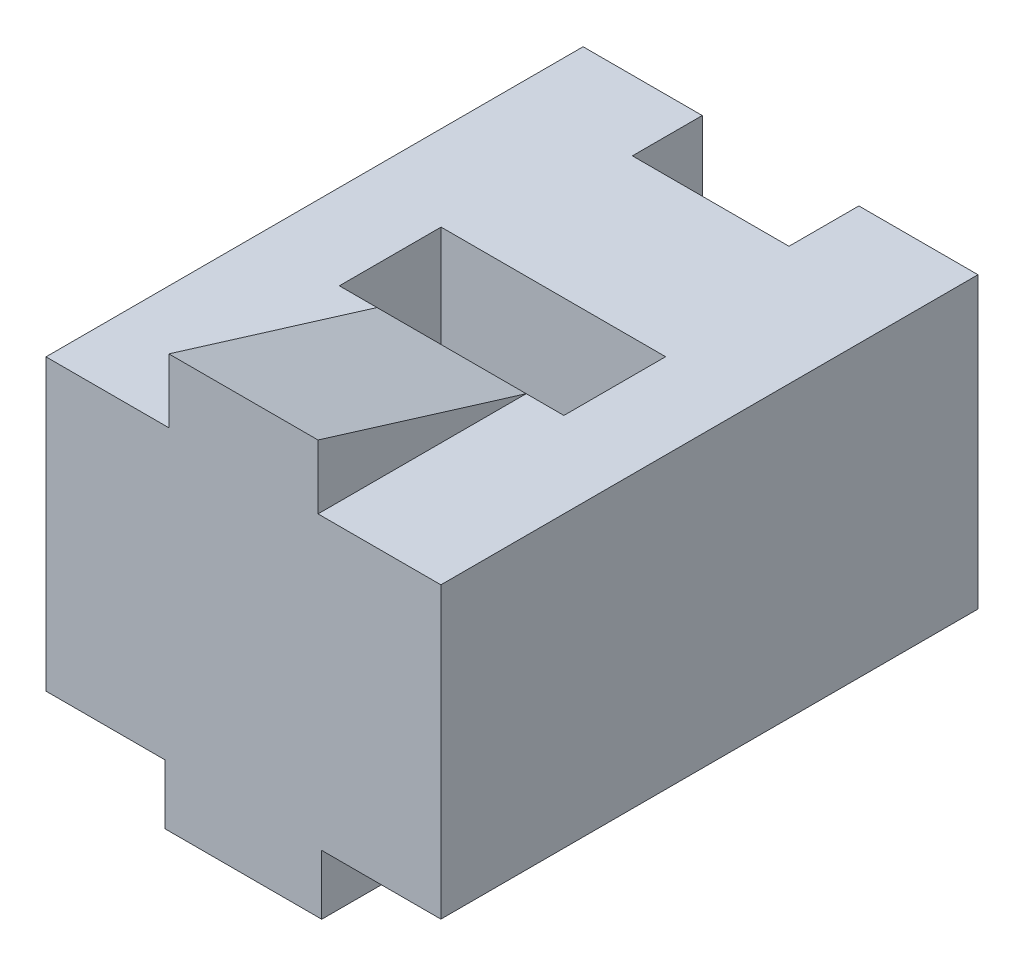
from build123d import *

# Parameters (mm, degrees)
SKETCH_1_W           = 132.33692867
SKETCH_1_H           = 97.034055892
EXTRUDE_1_DEPTH      = 180
SKETCH_2_W           = 37.625025254
SKETCH_2_H           = 34.08860124
SKETCH_2_W_2         = 26.240865703
SKETCH_2_H_2         = 23.4168688
CUT_EXTRUDE_2_DEPTH  = 215.927601009
SKETCH_6_W           = 26.240865703
SKETCH_6_H           = 22.681143593
EXTRUDE_2_DEPTH      = 20
EXTRUDE_3_DEPTH      = 25
EXTRUDE_3_DEPTH_BACK = 25


with BuildPart() as part:
    # Эскиз1 → Бобышка-Вытянуть1 (new body)
    with BuildSketch(Plane.XY):
        with Locations((0, -48.517027946)):
            Rectangle(SKETCH_1_W, SKETCH_1_H)
    extrude(amount=EXTRUDE_1_DEPTH)

    # Эскиз2 → Вырез-Вытянуть2 (cut, through all)
    with BuildSketch(Plane(origin=(0, 0, 0), x_dir=(1, 0, 0), z_dir=(0, 1, 0))):
        with Locations((-18.812512627, -93.188142562)):
            Rectangle(SKETCH_2_W, SKETCH_2_H)
        with Locations((18.812512627, -93.188142562)):
            Rectangle(SKETCH_2_W, SKETCH_2_H)
        with Locations((13.120432852, -11.7084344)):
            Rectangle(SKETCH_2_W_2, SKETCH_2_H_2)
        with Locations((-13.120432852, -11.7084344)):
            Rectangle(SKETCH_2_W_2, SKETCH_2_H_2)
    extrude(amount=-CUT_EXTRUDE_2_DEPTH, mode=Mode.SUBTRACT)

    # Эскиз6 → Бобышка-Вытянуть2 (add)
    with BuildSketch(Plane(origin=(0, -97.034055892, 0), x_dir=(-1, 0, 0), z_dir=(0, -1, 0))):
        with Locations((13.120432852, -168.659428203)):
            Rectangle(SKETCH_6_W, SKETCH_6_H)
        with Locations((-13.120432852, -168.659428203)):
            Rectangle(SKETCH_6_W, SKETCH_6_H)
    extrude(amount=EXTRUDE_2_DEPTH)

    # Эскиз8 → Бобышка-Вытянуть3 (add, two sides: drawn at the far end of the back side and taken through both)
    with BuildSketch(Plane(origin=(0, 0, 0), x_dir=(0, 0, -1), z_dir=(1, 0, 0)).offset(-EXTRUDE_3_DEPTH_BACK)):
        Polygon((-180, 0), (-180, 21.442823519), (-110.232443182, 0), align=None)
    extrude(amount=EXTRUDE_3_DEPTH + EXTRUDE_3_DEPTH_BACK)


solid = part.part
